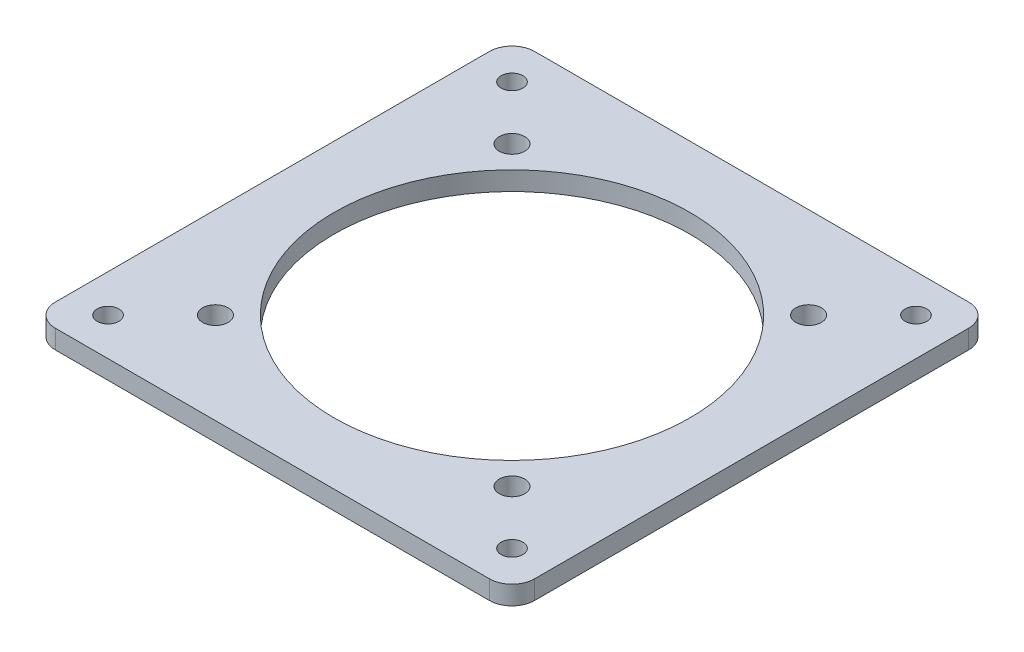
from build123d import *

# Parameters (mm, degrees)
SKETCH1_R           = 30
SKETCH1_R_2         = 2.15
SKETCH1_R_3         = 1.8288
BOSS_EXTRUDE1_DEPTH = 3.175


with BuildPart() as part:
    # Sketch1 → Boss-Extrude1 (new body)
    with BuildSketch(Plane(origin=(0, 0, 0), x_dir=(1, 0, 0), z_dir=(0, 1, 0))):
        with BuildLine():
            Line((-36.59, 40.4), (36.59, 40.4))
            ThreePointArc((36.59, 40.4), (39.284076836, 39.284076836), (40.4, 36.59))
            Line((40.4, 36.59), (40.4, -36.59))
            ThreePointArc((40.4, -36.59), (39.284076836, -39.284076836), (36.59, -40.4))
            Line((36.59, -40.4), (-36.59, -40.4))
            ThreePointArc((-36.59, -40.4), (-39.284076836, -39.284076836), (-40.4, -36.59))
            Line((-40.4, -36.59), (-40.4, 36.59))
            ThreePointArc((-40.4, 36.59), (-39.284076836, 39.284076836), (-36.59, 40.4))
        make_face()
        with Locations(Location((0, 0, 0), (0, 0, 270))):
            Circle(SKETCH1_R, mode=Mode.SUBTRACT)
        with Locations(Location((-25, 25, 0), (0, 0, 270))):
            Circle(SKETCH1_R_2, mode=Mode.SUBTRACT)
        with Locations(Location((25, 25, 0), (0, 0, 270))):
            Circle(SKETCH1_R_2, mode=Mode.SUBTRACT)
        with Locations(Location((25, -25, 0), (0, 0, 270))):
            Circle(SKETCH1_R_2, mode=Mode.SUBTRACT)
        with Locations(Location((-25, -25, 0), (0, 0, 270))):
            Circle(SKETCH1_R_2, mode=Mode.SUBTRACT)
        with Locations(Location((-34.05, 34.05, 0), (0, 0, 270))):
            Circle(SKETCH1_R_3, mode=Mode.SUBTRACT)
        with Locations(Location((34.05, 34.05, 0), (0, 0, 270))):
            Circle(SKETCH1_R_3, mode=Mode.SUBTRACT)
        with Locations(Location((34.05, -34.05, 0), (0, 0, 270))):
            Circle(SKETCH1_R_3, mode=Mode.SUBTRACT)
        with Locations(Location((-34.05, -34.05, 0), (0, 0, 270))):
            Circle(SKETCH1_R_3, mode=Mode.SUBTRACT)
    extrude(amount=BOSS_EXTRUDE1_DEPTH)


solid = part.part
